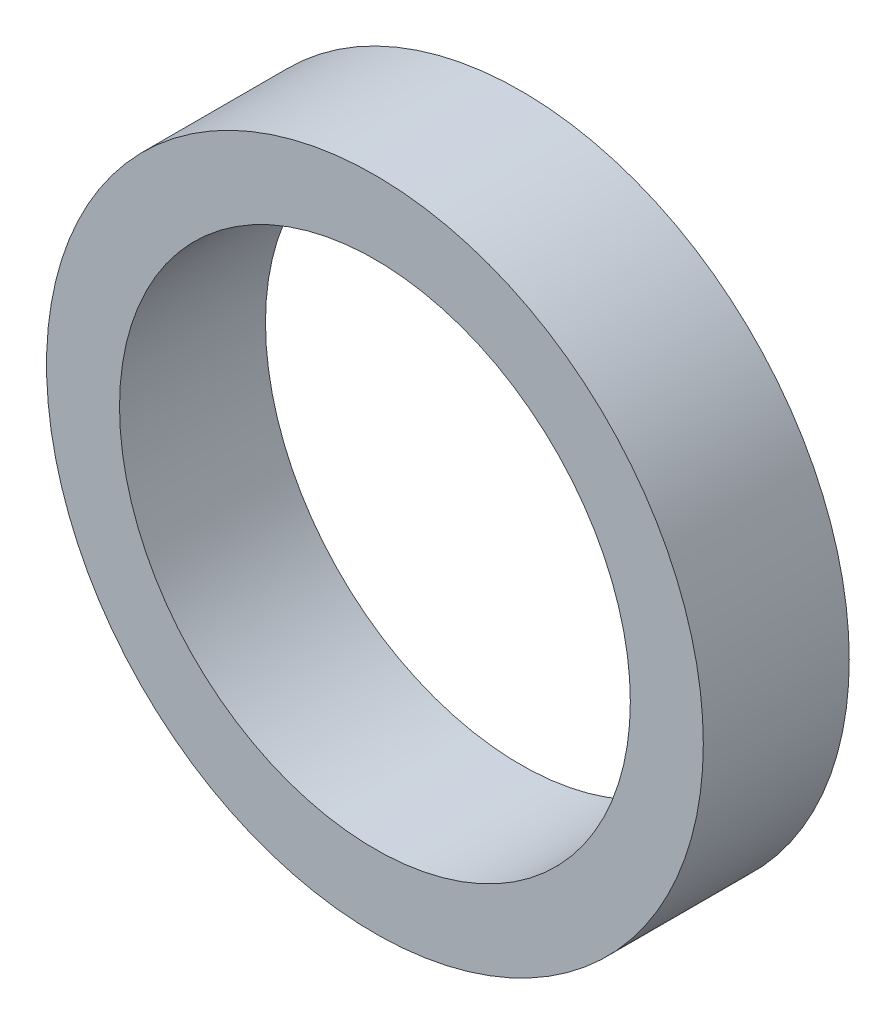
from build123d import *

# Parameters (mm, degrees)
SKIZZE1_R                       = 9
SKIZZE1_R_2                     = 7
AUFSATZ_LINEAR_AUSTRAGEN1_DEPTH = 4


with BuildPart() as part:
    # Skizze1 → Aufsatz-Linear austragen1 (new body)
    with BuildSketch(Plane.XY):
        Circle(SKIZZE1_R)
        Circle(SKIZZE1_R_2, mode=Mode.SUBTRACT)
    extrude(amount=AUFSATZ_LINEAR_AUSTRAGEN1_DEPTH)


solid = part.part
